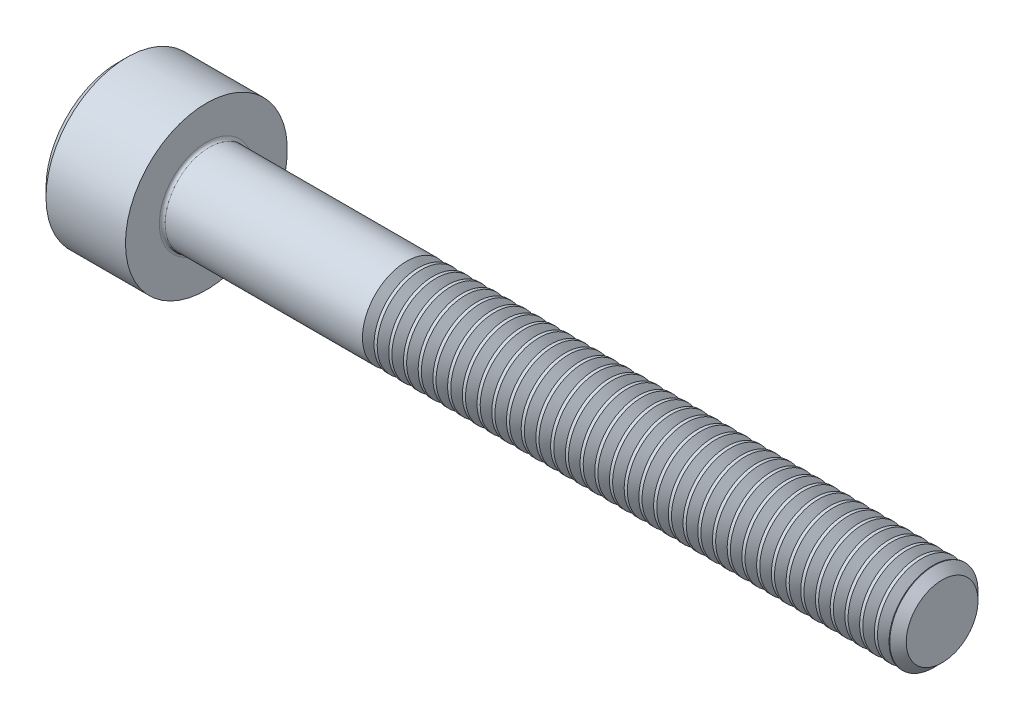
from build123d import *

# Parameters (mm, degrees)
FILLET1_R       = 0.1
HEX_2_DEPTH     = 1.3
THDSCHPAT_COUNT = 36
THDSCHPAT_PITCH = 0.5


with BuildPart() as part:
    # BodySke → Base-Revolve (revolve)
    with BuildSketch(Plane.XY, mode=Mode.PRIVATE) as base_revolve_sk:
        Polygon((0, 0), (0, 2.45), (0.3, 2.75), (3, 2.75), (3, 1.5), (27.7195, 1.5), (28, 1.2195), (28, 0), align=None)
    revolve(base_revolve_sk.sketch.rotate(Axis((-31.75, 0, 0), (1, 0, 0)), 90), axis=Axis((-31.75, 0, 0), (1, 0, 0)))

    # Fillet1
    fillet1_edges = [part.edges().sort_by_distance(p)[0] for p in [
        (3, 0, -1.5),
    ]]
    fillet(fillet1_edges, radius=FILLET1_R)

    # Sketch2 → Hex-PreBroach (revolve, cut)
    with BuildSketch(Plane.XY, mode=Mode.PRIVATE) as hex_prebroach_sk:
        Polygon((0, 1.28), (1.3, 1.28), (2.039008345, 0), (0, 0), align=None)
    revolve(hex_prebroach_sk.sketch.rotate(Axis((0, 0, 0), (1, 0, 0)), 90), axis=Axis((0, 0, 0), (1, 0, 0)), mode=Mode.SUBTRACT)

    # Sketch3 → Hex 2 (cut)
    with BuildSketch(Plane(origin=(0, 0, 0), x_dir=(0, 0.500000000000001, 0.866025403784438), z_dir=(-1, 0, 0))):
        Polygon((0.739008345, 1.28), (-0.739008345, 1.28), (-1.478016689, 0), (-0.739008345, -1.28), (0.739008345, -1.28), (1.478016689, 0), align=None)
    extrude(amount=-HEX_2_DEPTH, mode=Mode.SUBTRACT)

    # ThdSchSke → ThreadSchematic (revolve, cut)
    with BuildSketch(Plane.XY):
        Polygon((10, -1.2195), (9.803591786, -1.5), (9.803591786, -1.875), (10.196408214, -1.875), (10.196408214, -1.5), align=None)
    threadschematic = revolve(axis=Axis((-3.175, 0, 0), (1, 0, 0)), mode=Mode.SUBTRACT)

    # ThdSchPat: ThreadSchematic ×36
    with Locations(*[(i * THDSCHPAT_PITCH, 0, 0) for i in range(1, THDSCHPAT_COUNT)]):
        add(threadschematic, mode=Mode.SUBTRACT)


solid = part.part
